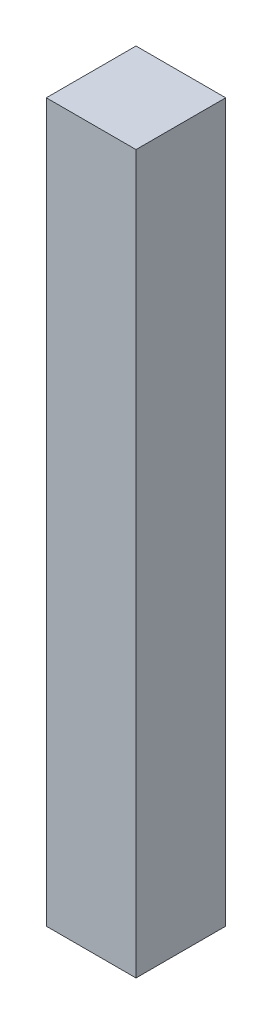
from build123d import *

# Parameters (mm, degrees)
SKETCH_1_W      = 2.5
SKETCH_1_H      = 20
EXTRUDE_5_DEPTH = 2.5


with BuildPart() as part:
    # 草图1 → 凸台-拉伸5 (new body)
    with BuildSketch(Plane.XY):
        with Locations((-55.092492076, 39.3885979)):
            Rectangle(SKETCH_1_W, SKETCH_1_H)
    extrude(amount=EXTRUDE_5_DEPTH)


solid = part.part
